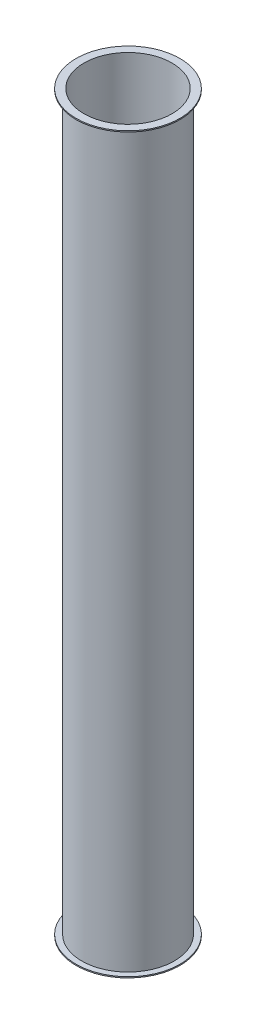
from build123d import *

# Parameters (mm, degrees)
SCHIZZO1_R                   = 41
SCHIZZO1_R_2                 = 39
ESTRUSIONE_SOTTILE1_DEPTH    = 325
SCHIZZO2_R                   = 46
SCHIZZO2_R_2                 = 41
ESTRUSIONE_ESTRUSIONE1_DEPTH = 1
ESTRUSIONE_ESTRUSIONE2_START = -1
SCHIZZO3_R                   = 46
SCHIZZO3_R_2                 = 41
ESTRUSIONE_ESTRUSIONE2_DEPTH = 1


with BuildPart() as part:
    # Schizzo1 → Estrusione-Sottile1 (new, symmetric)
    with BuildSketch(Plane(origin=(0, 0, 0), x_dir=(1, 0, 0), z_dir=(0, 1, 0))):
        Circle(SCHIZZO1_R)
        Circle(SCHIZZO1_R_2, mode=Mode.SUBTRACT)
    extrude(amount=ESTRUSIONE_SOTTILE1_DEPTH, both=True)

    # Schizzo2 → Estrusione-Estrusione1 (add)
    with BuildSketch(Plane(origin=(0, 325, 0), x_dir=(1, 0, 0), z_dir=(0, 1, 0))):
        with Locations(Location((0, 0, 0), (0, 0, 270))):
            Circle(SCHIZZO2_R)
        Circle(SCHIZZO2_R_2, mode=Mode.SUBTRACT)
    extrude(amount=-ESTRUSIONE_ESTRUSIONE1_DEPTH)

    # Schizzo3 → Estrusione-Estrusione2 (add)
    with BuildSketch(Plane.XZ.offset(325).offset(ESTRUSIONE_ESTRUSIONE2_START)):
        with Locations(Location((0, 0, 0), (0, 0, 90))):
            Circle(SCHIZZO3_R)
        with Locations(Location((0, 0, 0), (0, 0, 270))):
            Circle(SCHIZZO3_R_2, mode=Mode.SUBTRACT)
    extrude(amount=ESTRUSIONE_ESTRUSIONE2_DEPTH)


solid = part.part
